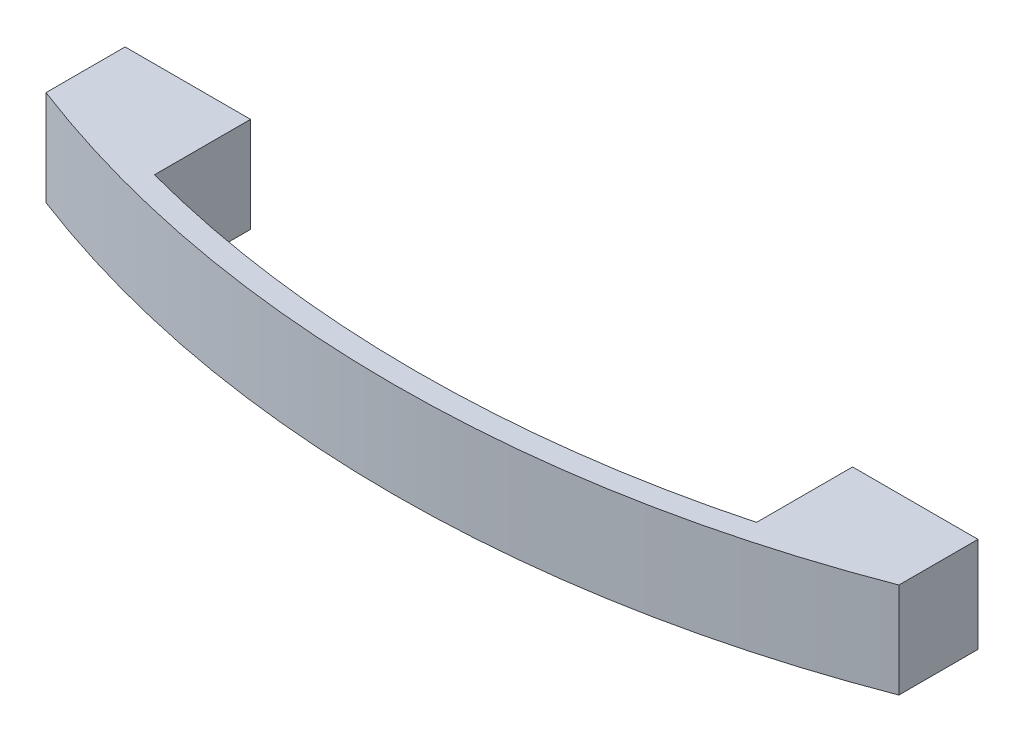
from build123d import *

# Parameters (mm, degrees)
EXTRUDE_1_DEPTH = 19
CHAMFER_1_SIZE  = 1


with BuildPart() as part:
    # 草图1 → 凸台-拉伸1 (new body)
    with BuildSketch(Plane(origin=(0, 0, 0), x_dir=(1, 0, 0), z_dir=(0, 1, 0))):
        with BuildLine():
            Line((60, -225.142177301), (60, -205))
            Line((60, -205), (85, -205))
            Line((85, -205), (85, -221.768460336))
            ThreePointArc((85, -221.768460336), (0, -237.5), (-85, -221.768460336))
            Line((-85, -221.768460336), (-85, -205))
            Line((-85, -205), (-60, -205))
            Line((-60, -205), (-60, -225.142177301))
            ThreePointArc((-60, -225.142177301), (0, -233), (60, -225.142177301))
        make_face()
    extrude(amount=EXTRUDE_1_DEPTH)

    # 倒角1
    chamfer_1_edges = [part.edges().sort_by_distance(p)[0] for p in [
        (-72.5, 0, 205),
        (-72.5, 19, 205),
        (60, 9.5, 205),
        (85, 9.5, 205),
        (-85, 9.5, 205),
        (-60, 9.5, 205),
        (72.5, 19, 205),
        (72.5, 0, 205),
    ]]
    chamfer(chamfer_1_edges, length=CHAMFER_1_SIZE)


solid = part.part
